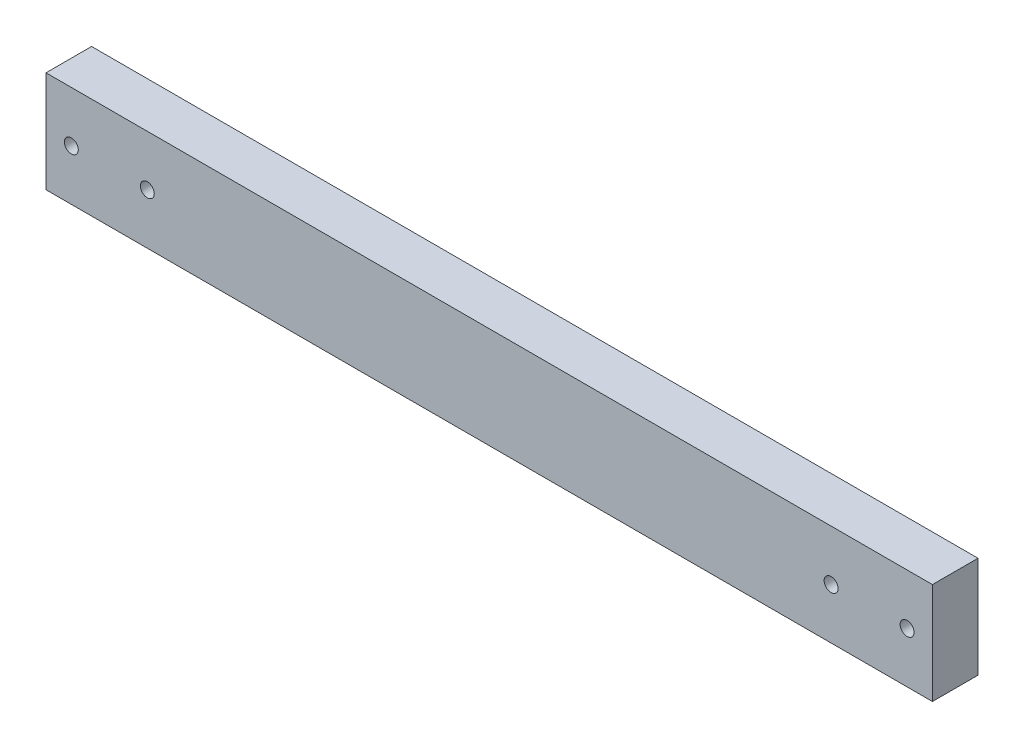
from build123d import *

# Parameters (mm, degrees)
SKETCH1_W           = 350
SKETCH1_H           = 40
BOSS_EXTRUDE1_DEPTH = 18
SKETCH2_R           = 2.75
CUT_EXTRUDE1_DEPTH  = 20


with BuildPart() as part:
    # Sketch1 → Boss-Extrude1 (new body)
    with BuildSketch(Plane.XY):
        with Locations((175, 20)):
            Rectangle(SKETCH1_W, SKETCH1_H)
    extrude(amount=BOSS_EXTRUDE1_DEPTH)

    # Sketch2 → Cut-Extrude1 (cut)
    with BuildSketch(Plane.XY.offset(18)):
        with Locations((10, 20)):
            Circle(SKETCH2_R)
        with Locations((40, 20)):
            Circle(SKETCH2_R)
        with Locations((310, 20)):
            Circle(SKETCH2_R)
        with Locations((340, 20)):
            Circle(SKETCH2_R)
    extrude(amount=-CUT_EXTRUDE1_DEPTH, mode=Mode.SUBTRACT)


solid = part.part
